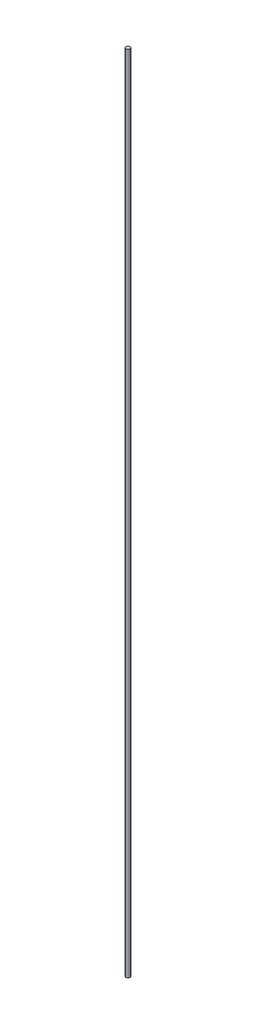
from build123d import *

# Parameters (mm, degrees)
SKETCH1_R           = 0.75
BOSS_EXTRUDE1_DEPTH = 300


with BuildPart() as part:
    # Sketch1 → Boss-Extrude1 (new body)
    with BuildSketch(Plane(origin=(0, 0, 0), x_dir=(1, 0, 0), z_dir=(0, 1, 0))):
        with Locations(Location((0, 0, 0), (0, 0, 270))):
            Circle(SKETCH1_R)
    extrude(amount=BOSS_EXTRUDE1_DEPTH)


solid = part.part
